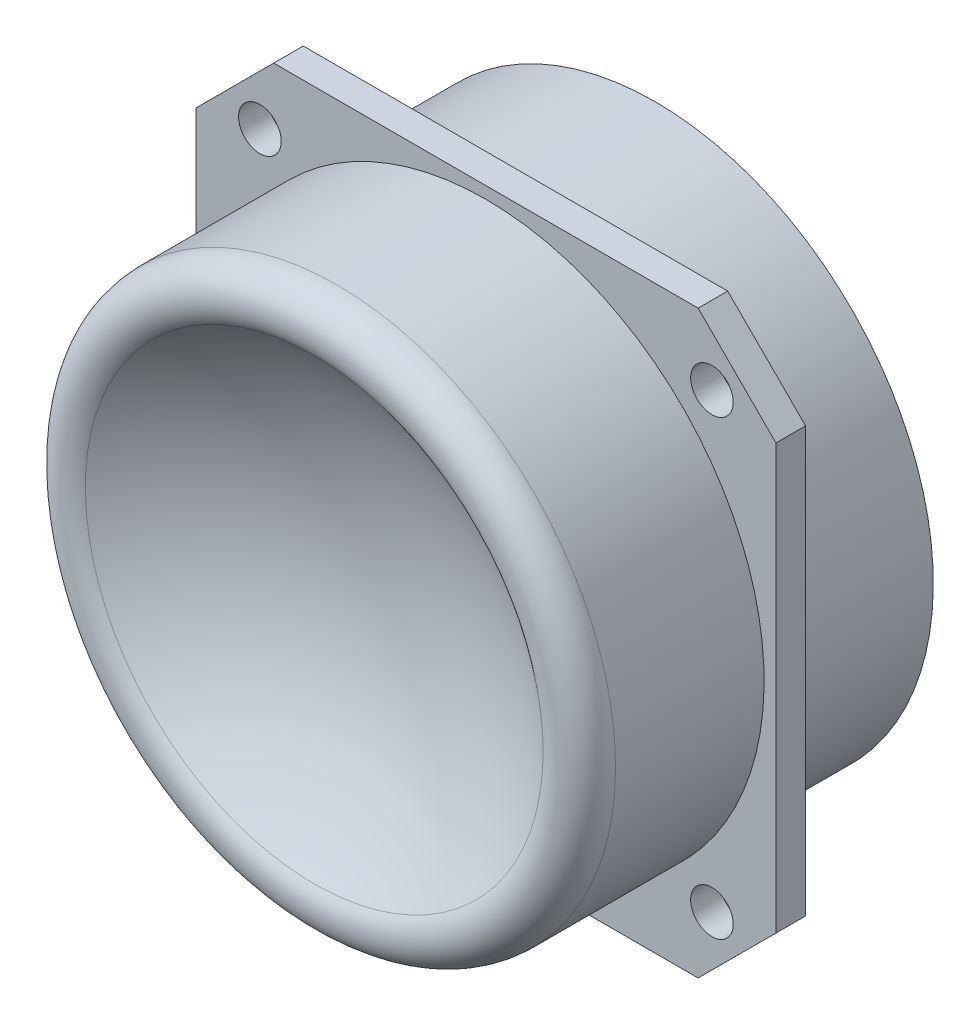
from build123d import *

# Parameters (mm, degrees)
SKETCH1_W                  = 49
SKETCH1_H                  = 49
BOSS_EXTRUDE1_DEPTH        = 2.5
CUT_EXTRUDE1_DEPTH         = 2.5
F_3_6_3_6_DIAMETER_HOLE1_D = 3.6


with BuildPart() as part:
    # Sketch1 → Boss-Extrude1 (new body)
    with BuildSketch(Plane.XY):
        Rectangle(SKETCH1_W, SKETCH1_H)
    extrude(amount=-BOSS_EXTRUDE1_DEPTH)

    # Sketch2 → Revolve1 (revolve)
    with BuildSketch(Plane(origin=(0, 0, 0), x_dir=(0, 0, -1), z_dir=(1, 0, 0))):
        with BuildLine():
            Line((14.29, 0), (14.29, 23.5))
            Line((14.29, 23.5), (-12.55, 23.5))
            ThreePointArc((-12.55, 23.5), (-14.850205099, 22.037337692), (-14.501257994, 19.333902758))
            ThreePointArc((-14.501257994, 19.333902758), (-9.305131525, 10.281048048), (-7.501257994, 0))
            Line((-7.501257994, 0), (14.29, 0))
        make_face()
    revolve(axis=Axis((0, 0, 0), (0, 0, 1)))

    # Sketch3 → Cut-Extrude1 (cut)
    with BuildSketch(Plane.XY):
        Polygon((-24.5, 17.926406871), (-17.926406871, 24.5), (-24.5, 24.5), align=None)
        Polygon((24.5, 17.926406871), (17.926406871, 24.5), (24.5, 24.5), align=None)
        Polygon((-24.5, -17.926406871), (-24.5, -24.5), (-17.926406871, -24.5), align=None)
        Polygon((24.5, -17.926406871), (17.926406871, -24.5), (24.5, -24.5), align=None)
    extrude(amount=-CUT_EXTRUDE1_DEPTH, mode=Mode.SUBTRACT)

    # Ø3.6 (3.6) Diameter Hole1 (through all)
    with Locations(Plane.XY):
        with Locations((-19.091883092, 19.091883092), (19.091883092, -19.091883092), (-19.091883092, -19.091883092), (19.091883092, 19.091883092)):
            Hole(F_3_6_3_6_DIAMETER_HOLE1_D / 2)


solid = part.part
